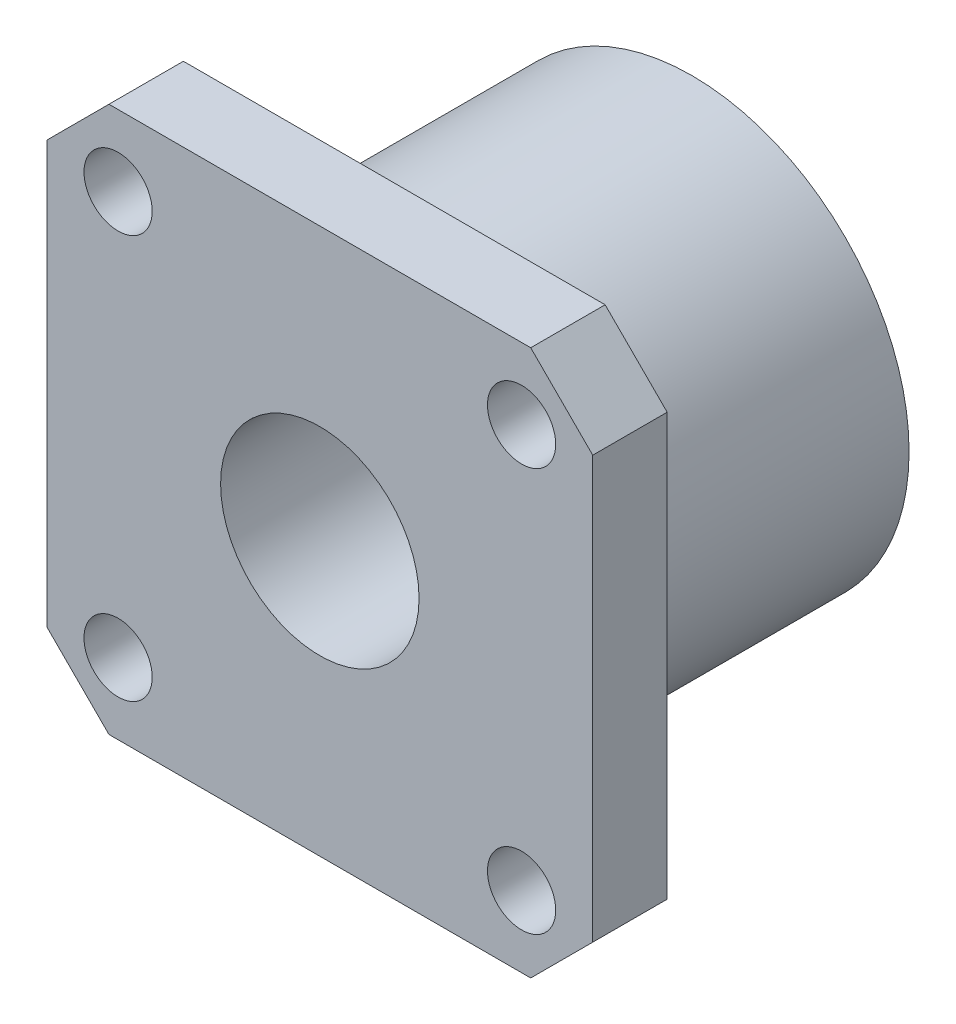
from build123d import *

# Parameters (mm, degrees)
SKETCH_1_W          = 44
SKETCH_1_H          = 44
SKETCH_1_R          = 2.75
EXTRUDE_1_DEPTH     = 6
CHAMFER_1_SIZE      = 5
SKETCH_2_R          = 17.5
SKETCH_2_R_2        = 8
EXTRUDE_2_DEPTH     = 24
SKETCH_3_R          = 8
CUT_EXTRUDE_1_DEPTH = 40.293765409


with BuildPart() as part:
    # 草图1 → 凸台-拉伸1 (new body)
    with BuildSketch(Plane.XY):
        Rectangle(SKETCH_1_W, SKETCH_1_H)
        with Locations((-16.263455967, 16.263455967)):
            Circle(SKETCH_1_R, mode=Mode.SUBTRACT)
        with Locations((16.263455967, 16.263455967)):
            Circle(SKETCH_1_R, mode=Mode.SUBTRACT)
        with Locations((16.263455967, -16.263455967)):
            Circle(SKETCH_1_R, mode=Mode.SUBTRACT)
        with Locations((-16.263455967, -16.263455967)):
            Circle(SKETCH_1_R, mode=Mode.SUBTRACT)
    extrude(amount=EXTRUDE_1_DEPTH)

    # 倒角1
    chamfer_1_edges = [part.edges().sort_by_distance(p)[0] for p in [
        (-22, 22, 3),
        (22, 22, 3),
        (22, -22, 3),
        (-22, -22, 3),
    ]]
    chamfer(chamfer_1_edges, length=CHAMFER_1_SIZE)

    # 草图2 → 凸台-拉伸2 (add)
    with BuildSketch(Plane(origin=(0, 0, 0), x_dir=(-1, 0, 0), z_dir=(0, 0, -1))):
        with Locations(Location((0, 0, 0), (0, 0, 180))):
            Circle(SKETCH_2_R)
        Circle(SKETCH_2_R_2, mode=Mode.SUBTRACT)
    extrude(amount=EXTRUDE_2_DEPTH)

    # 草图3 → 切除-拉伸1 (cut, through all)
    with BuildSketch(Plane(origin=(0, 0, 0), x_dir=(-1, 0, 0), z_dir=(0, 0, -1))):
        Circle(SKETCH_3_R)
    extrude(amount=-CUT_EXTRUDE_1_DEPTH, mode=Mode.SUBTRACT)


solid = part.part
